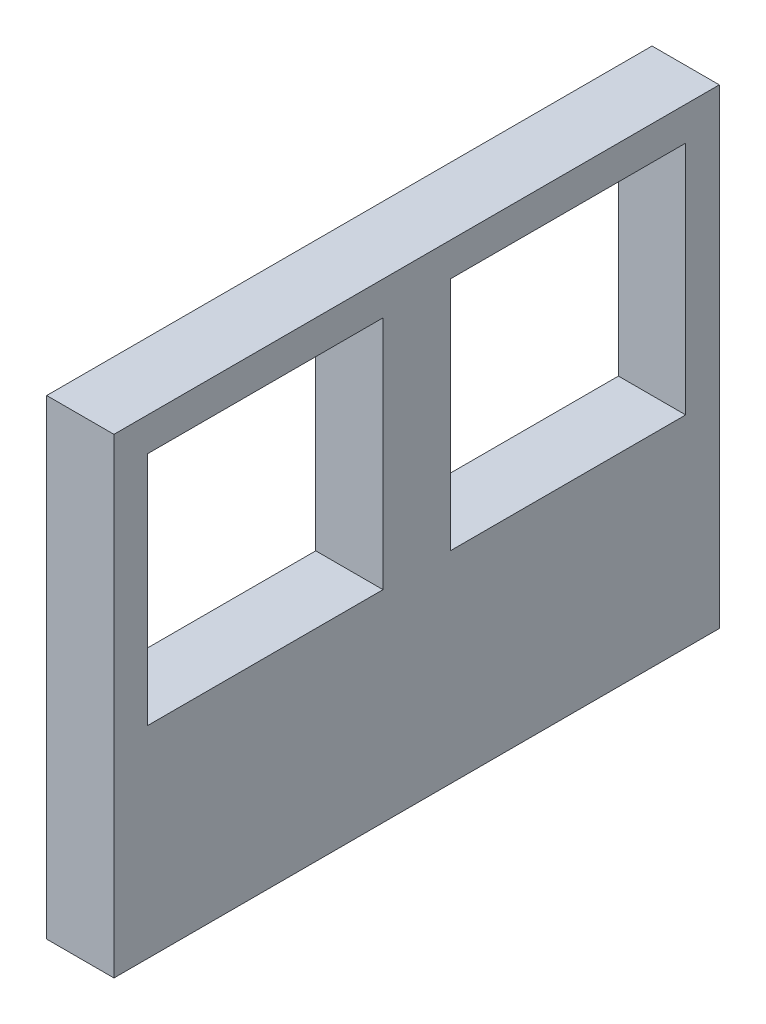
from build123d import *

# Parameters (mm, degrees)
EXTRUDE_1_DEPTH = 4


with BuildPart() as part:
    # Sketch 1 → Бобышка-Вытянуть1 (new body)
    with BuildSketch(Plane(origin=(1e-09, -39.529244173, -14.757642275), x_dir=(9.977709055986143e-13, 0.6139406135149353, 0.7893522173763147), z_dir=(1.0, -1.5354534328683506e-11, 1.0678377959596007e-11))):
        Polygon((0, 0), (28.416679826, 22.101862087), (45.607017004, 0), (17.190337178, -22.101862087), align=None)
        Polygon((34.205262753, 11.401754251), (42.800431342, 0.350823208), (31.749500299, -8.244345381), (23.15433171, 2.806585662), align=None, mode=Mode.SUBTRACT)
        Polygon((8.945991797, -8.244345381), (19.99692284, 0.350823208), (28.592091429, -10.700107836), (17.541160386, -19.295276425), align=None, mode=Mode.SUBTRACT)
    extrude(amount=EXTRUDE_1_DEPTH)


solid = part.part
